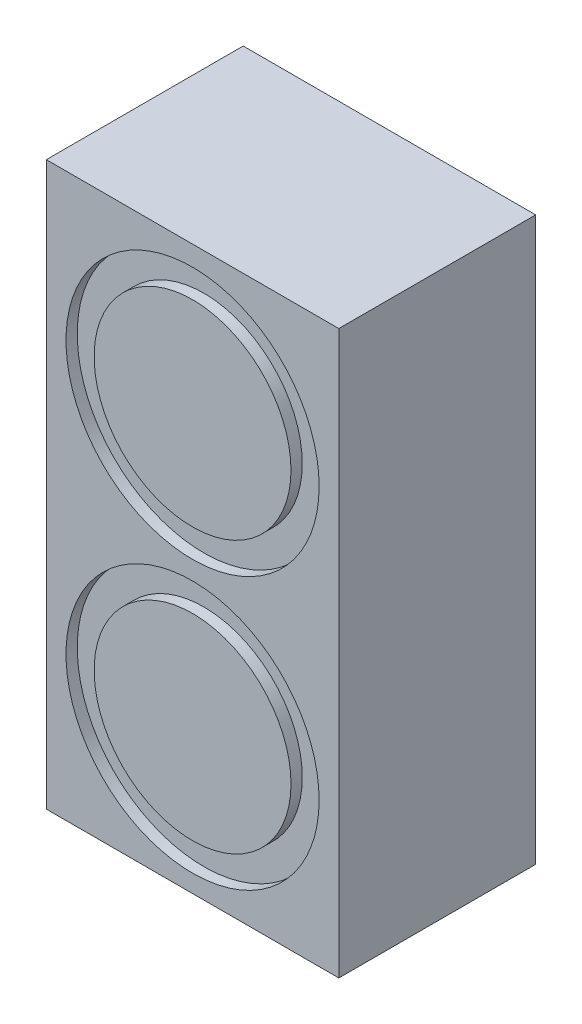
from build123d import *

# Parameters (mm, degrees)
SKETCH_1_W          = 52
SKETCH_1_H          = 100
EXTRUDE_1_DEPTH     = 35
SKETCH_2_R          = 22.5
SKETCH_2_R_2        = 17.5
CUT_EXTRUDE_1_DEPTH = 2


with BuildPart() as part:
    # 草圖1 → 填料-伸長1 (new body)
    with BuildSketch(Plane.XY):
        with Locations((-4.941582483, -21.722113503)):
            Rectangle(SKETCH_1_W, SKETCH_1_H)
    extrude(amount=EXTRUDE_1_DEPTH)

    # 草圖2 → 除料-伸長1 (cut)
    # profile 1 of 2: a face of its own
    with BuildSketch(Plane.XY.offset(35)):
        with Locations((-4.941582483, 2.224790527)):
            Circle(SKETCH_2_R)
        with Locations((-4.941582483, 2.224790527)):
            Circle(SKETCH_2_R_2, mode=Mode.SUBTRACT)
    # profile 2 of 2: a face of its own
    with BuildSketch(Plane.XY.offset(35)):
        with Locations((-4.941582483, -46.083085038)):
            Circle(SKETCH_2_R)
        with Locations((-4.941582483, -46.083085038)):
            Circle(SKETCH_2_R_2, mode=Mode.SUBTRACT)
    extrude(amount=-CUT_EXTRUDE_1_DEPTH, mode=Mode.SUBTRACT)


solid = part.part
